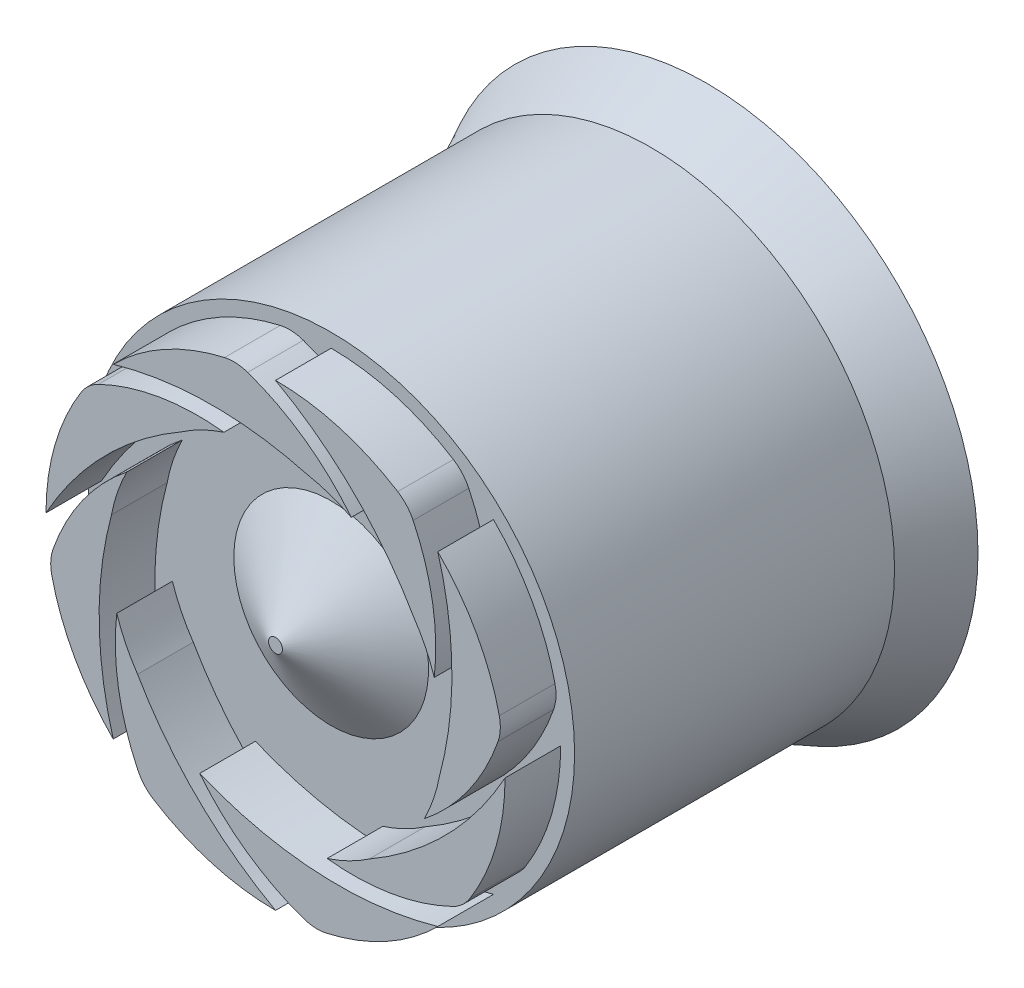
from build123d import *

# Parameters (mm, degrees)
SKETCH_21_R         = 1.75
EXTRUDE_8_DEPTH     = 0.3
SKETCH_22_R         = 0.7
CUT_EXTRUDE_4_DEPTH = 0.3
EXTRUDE_START       = -2
SKETCH_24_R         = 1.75
SKETCH_24_R_2       = 1.65
EXTRUDE_9_DEPTH     = 2
EXTRUDE_10_DEPTH    = 0.4


with BuildPart() as part:
    # 스케치21 → 보스-돌출8 (new body)
    with BuildSketch(Plane(origin=(0, -5.7, 0), x_dir=(-1, 0, 0), z_dir=(0, 0, 1))):
        with Locations(Location((0, -5.7, 0), (0, 0, 180))):
            Circle(SKETCH_21_R)
    extrude(amount=EXTRUDE_8_DEPTH)

    # 스케치22 → 컷-돌출4 (cut)
    with BuildSketch(Plane(origin=(0, 0, 0.3), x_dir=(-1, 0, 0), z_dir=(0, 0, 1))):
        with Locations(Location((0, 0, 0), (0, 0, 180))):
            Circle(SKETCH_22_R)
    extrude(amount=-CUT_EXTRUDE_4_DEPTH, mode=Mode.SUBTRACT)

    # 스케치23 → 회전4 (revolve)
    with BuildSketch(Plane(origin=(0, 0, 0), x_dir=(1, 0, 0), z_dir=(0, 1, 0)), mode=Mode.PRIVATE) as revolve_4_sk:
        Polygon((0.7, -0.3), (0.7, 0), (0, -0.430769231), (0, -0.7), (0.05, -0.7), align=None)
    revolve(revolve_4_sk.sketch.rotate(Axis((0, 0, 0.7), (0, 0, -1)), 180), axis=Axis((0, 0, 0.7), (0, 0, -1)))

    # 스케치24 → 보스-돌출9 (add)
    with BuildSketch(Plane.XY.offset(EXTRUDE_START)):
        Circle(SKETCH_24_R)
        Circle(SKETCH_24_R_2, mode=Mode.SUBTRACT)
    extrude(amount=EXTRUDE_9_DEPTH)

    # 스케치33 → 보스-돌출10 (add)
    with BuildSketch(Plane.XY.offset(0.3)):
        with BuildLine():
            ThreePointArc((-0.200344113, 1.599365846), (-0.282671821, 1.615821098), (-0.366335413, 1.608818935))
            ThreePointArc((-0.366335413, 1.608818935), (-0.797766236, 1.444323036), (-1.166726189, 1.166726189))
            ThreePointArc((-1.166726189, 1.166726189), (-0.472406232, 1.268123752), (0.223593744, 1.178985088))
            ThreePointArc((0.223593744, 1.178985088), (0.388035033, 1.13553019), (0.544680788, 1.069262755))
            ThreePointArc((0.544680788, 1.069262755), (0.209622019, 1.386952977), (-0.200344113, 1.599365846))
        make_face()
        with BuildLine():
            ThreePointArc((0.989257755, 1.272587116), (0.942678894, 1.342437217), (0.878568524, 1.396645033))
            ThreePointArc((0.878568524, 1.396645033), (0.457184697, 1.585396528), (0, 1.65))
            ThreePointArc((0, 1.65), (0.562657254, 1.230740555), (0.991773003, 0.675563698))
            ThreePointArc((0.991773003, 0.675563698), (1.077323301, 0.528558895), (1.141230424, 0.370935466))
            ThreePointArc((1.141230424, 0.370935466), (1.128949006, 0.832498704), (0.989257755, 1.272587116))
        make_face()
        with BuildLine():
            ThreePointArc((1.599365846, 0.200344113), (1.615821098, 0.282671821), (1.608818935, 0.366335413))
            ThreePointArc((1.608818935, 0.366335413), (1.444323036, 0.797766236), (1.166726189, 1.166726189))
            ThreePointArc((1.166726189, 1.166726189), (1.268123752, 0.472406232), (1.178985088, -0.223593744))
            ThreePointArc((1.178985088, -0.223593744), (1.13553019, -0.388035033), (1.069262755, -0.544680788))
            ThreePointArc((1.069262755, -0.544680788), (1.386952977, -0.209622019), (1.599365846, 0.200344113))
        make_face()
        with BuildLine():
            ThreePointArc((1.396645033, -0.878568524), (1.585396528, -0.457184697), (1.65, 0))
            ThreePointArc((1.65, 0), (1.230740555, -0.562657254), (0.675563698, -0.991773003))
            ThreePointArc((0.675563698, -0.991773003), (0.528558895, -1.077323301), (0.370935466, -1.141230424))
            ThreePointArc((0.370935466, -1.141230424), (0.832498704, -1.128949006), (1.272587116, -0.989257755))
            ThreePointArc((1.272587116, -0.989257755), (1.342437217, -0.942678894), (1.396645033, -0.878568524))
        make_face()
        with BuildLine():
            ThreePointArc((-0.878568524, -1.396645033), (-0.457184697, -1.585396528), (0, -1.65))
            ThreePointArc((0, -1.65), (-0.562657254, -1.230740555), (-0.991773003, -0.675563698))
            ThreePointArc((-0.991773003, -0.675563698), (-1.077323301, -0.528558895), (-1.141230424, -0.370935466))
            ThreePointArc((-1.141230424, -0.370935466), (-1.128949006, -0.832498704), (-0.989257755, -1.272587116))
            ThreePointArc((-0.989257755, -1.272587116), (-0.942678894, -1.342437217), (-0.878568524, -1.396645033))
        make_face()
        with BuildLine():
            ThreePointArc((-1.608818935, -0.366335413), (-1.444323036, -0.797766236), (-1.166726189, -1.166726189))
            ThreePointArc((-1.166726189, -1.166726189), (-1.268123752, -0.472406232), (-1.178985088, 0.223593744))
            ThreePointArc((-1.178985088, 0.223593744), (-1.13553019, 0.388035033), (-1.069262755, 0.544680788))
            ThreePointArc((-1.069262755, 0.544680788), (-1.386952977, 0.209622019), (-1.599365846, -0.200344113))
            ThreePointArc((-1.599365846, -0.200344113), (-1.615821098, -0.282671821), (-1.608818935, -0.366335413))
        make_face()
        with BuildLine():
            ThreePointArc((-1.272587116, 0.989257755), (-1.342437217, 0.942678894), (-1.396645033, 0.878568524))
            ThreePointArc((-1.396645033, 0.878568524), (-1.585396528, 0.457184697), (-1.65, 0))
            ThreePointArc((-1.65, 0), (-1.230740555, 0.562657254), (-0.675563698, 0.991773003))
            ThreePointArc((-0.675563698, 0.991773003), (-0.528558895, 1.077323301), (-0.370935466, 1.141230424))
            ThreePointArc((-0.370935466, 1.141230424), (-0.832498704, 1.128949006), (-1.272587116, 0.989257755))
        make_face()
        with BuildLine():
            ThreePointArc((1.166726189, -1.166726189), (0.797766236, -1.444323036), (0.366335413, -1.608818935))
            ThreePointArc((0.366335413, -1.608818935), (0.282671821, -1.615821098), (0.200344113, -1.599365846))
            ThreePointArc((0.200344113, -1.599365846), (-0.209622019, -1.386952977), (-0.544680788, -1.069262755))
            ThreePointArc((-0.544680788, -1.069262755), (0.302705274, -1.264044139), (1.166726189, -1.166726189))
        make_face()
    extrude(amount=EXTRUDE_10_DEPTH)

    # 스케치36 → 회전5 (revolve)
    with BuildSketch(Plane(origin=(0, 0, 0), x_dir=(1, 0, 0), z_dir=(0, 1, 0))):
        Polygon((1.75, 2), (1.95, 2.4), (1.85, 2.4), (1.65, 2), align=None)
    revolve(axis=Axis((0, 0, 0), (0, 0, -1)))


solid = part.part
